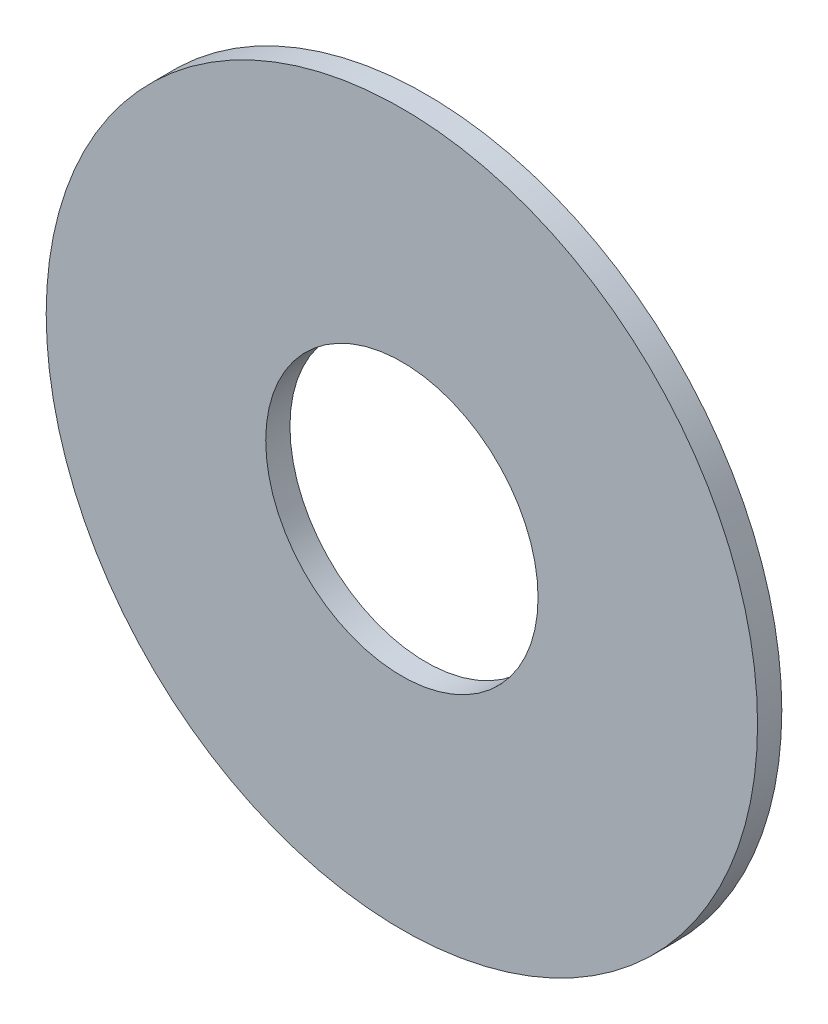
from build123d import *

# Parameters (mm, degrees)
BOSS_EXTRUDE1_DEPTH      = 0.3175
BOSS_EXTRUDE1_DEPTH_BACK = 0.3175
SKETCH3_R                = 9.3218
SKETCH3_R_2              = 3.5687


with BuildPart() as part:
    # Sketch3 → Boss-Extrude1 (new, two sides: drawn at the far end of the back side and taken through both)
    with BuildSketch(Plane.XY.offset(-BOSS_EXTRUDE1_DEPTH_BACK)):
        Circle(SKETCH3_R)
        Circle(SKETCH3_R_2, mode=Mode.SUBTRACT)
    extrude(amount=BOSS_EXTRUDE1_DEPTH + BOSS_EXTRUDE1_DEPTH_BACK)


solid = part.part
